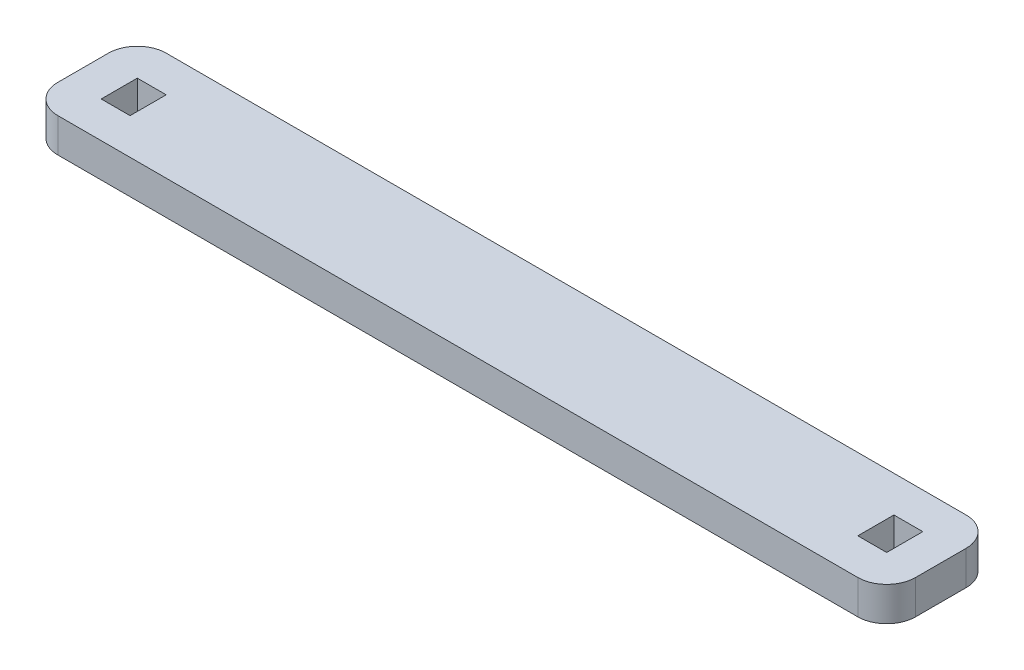
from build123d import *

# Parameters (mm, degrees)
SKETCH1_W           = 75.438
SKETCH1_H           = 9.525
SKETCH1_W_2         = 2.54
SKETCH1_H_2         = 3.175
BOSS_EXTRUDE1_DEPTH = 1.5
FILLET1_R           = 2.54


with BuildPart() as part:
    # Sketch1 → Boss-Extrude1 (new, symmetric)
    with BuildSketch(Plane(origin=(0, 0, 0), x_dir=(1, 0, 0), z_dir=(0, 1, 0))):
        Rectangle(SKETCH1_W, SKETCH1_H)
        with Locations((-33.274, 0)):
            Rectangle(SKETCH1_W_2, SKETCH1_H_2, mode=Mode.SUBTRACT)
        with Locations((33.274, 0)):
            Rectangle(SKETCH1_W_2, SKETCH1_H_2, mode=Mode.SUBTRACT)
    extrude(amount=BOSS_EXTRUDE1_DEPTH, both=True)

    # Fillet1
    fillet1_edges = [part.edges().sort_by_distance(p)[0] for p in [
        (-37.719, 0, -4.7625),
        (37.719, 0, -4.7625),
        (37.719, 0, 4.7625),
        (-37.719, 0, 4.7625),
    ]]
    fillet(fillet1_edges, radius=FILLET1_R)


solid = part.part
